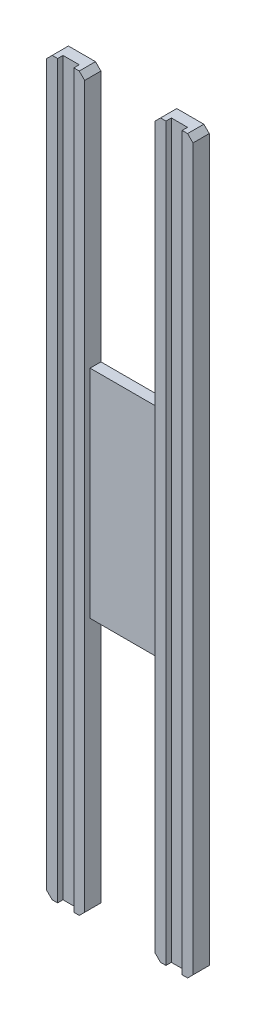
from build123d import *

# Parameters (mm, degrees)
SCHIZZO1_W                   = 6.5
SCHIZZO1_H                   = 40
ESTRUSIONE_ESTRUSIONE1_DEPTH = 2
SCHIZZO2_W                   = 3
SCHIZZO2_H                   = 135
ESTRUSIONE_ESTRUSIONE2_DEPTH = 7
SMUSSO1_SIZE                 = 1
SCHIZZO4_W                   = 3
SCHIZZO4_H                   = 1
TAGLIO_ESTRUSIONE1_DEPTH     = 136.706484738
SMUSSO1_OF_SPECCHIA9_SIZE    = 1


with BuildPart() as part:
    # Schizzo1 → Estrusione-Estrusione1 (new body)
    with BuildSketch(Plane.XY):
        with Locations((3.25, 20)):
            Rectangle(SCHIZZO1_W, SCHIZZO1_H)
    estrusione_estrusione1 = extrude(amount=ESTRUSIONE_ESTRUSIONE1_DEPTH)

    # Schizzo2 → Estrusione-Estrusione2 (add)
    with BuildSketch(Plane(origin=(6.5, 0, 0), x_dir=(0, 0, -1), z_dir=(1, 0, 0))):
        with Locations((-1.5, 20)):
            Rectangle(SCHIZZO2_W, SCHIZZO2_H)
    estrusione_estrusione2 = extrude(amount=ESTRUSIONE_ESTRUSIONE2_DEPTH)

    # Smusso1
    smusso1_edges = [part.edges().sort_by_distance(p)[0] for p in [
        (6.5, 87.5, 1.5),
        (6.5, -47.5, 1.5),
        (13.5, 87.5, 1.5),
        (13.5, -47.5, 1.5),
    ]]
    chamfer(smusso1_edges, length=SMUSSO1_SIZE)

    # Schizzo4 → Taglio-Estrusione1 (cut, through all)
    with BuildSketch(Plane.XZ.offset(47.5)):
        with Locations((10, 2.5)):
            Rectangle(SCHIZZO4_W, SCHIZZO4_H)
    taglio_estrusione1 = extrude(amount=-TAGLIO_ESTRUSIONE1_DEPTH, mode=Mode.SUBTRACT)

    # Specchia9: Estrusione-Estrusione1, Estrusione-Estrusione2, Taglio-Estrusione1 across plane
    add(estrusione_estrusione1.mirror(Plane.ZY))
    add(estrusione_estrusione2.mirror(Plane.ZY))
    add(taglio_estrusione1.mirror(Plane.ZY), mode=Mode.SUBTRACT)

    # Smusso1 of Specchia9
    smusso1_of_specchia9_edges = [part.edges().sort_by_distance(p)[0] for p in [
        (-6.5, 87.5, 1.5),
        (-6.5, -47.5, 1.5),
        (-13.5, 87.5, 1.5),
        (-13.5, -47.5, 1.5),
    ]]
    chamfer(smusso1_of_specchia9_edges, length=SMUSSO1_OF_SPECCHIA9_SIZE)


solid = part.part
